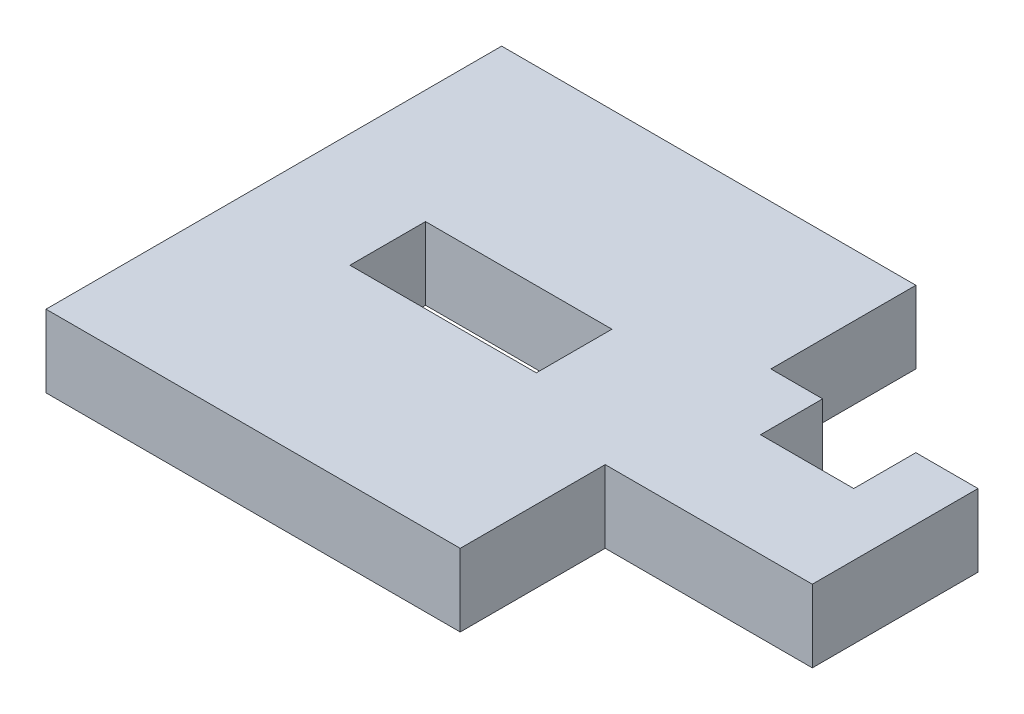
from build123d import *

# Parameters (mm, degrees)
SKETCH1_W           = 20
SKETCH1_H           = 22
SKETCH1_W_2         = 9
SKETCH1_H_2         = 3.65
BOSS_EXTRUDE1_DEPTH = 4
SKETCH2_W           = 10
SKETCH2_H           = 8
BOSS_EXTRUDE3_DEPTH = 4
SKETCH3_W           = 4.5
SKETCH3_H           = 3
CUT_EXTRUDE1_DEPTH  = 24.173260453
CHAMFER1_SIZE       = 0.5


with BuildPart() as part:
    # Sketch1 → Boss-Extrude1 (new body)
    with BuildSketch(Plane(origin=(0, 0, 0), x_dir=(1, 0, 0), z_dir=(0, 1, 0))):
        Rectangle(SKETCH1_W, SKETCH1_H)
        Rectangle(SKETCH1_W_2, SKETCH1_H_2, mode=Mode.SUBTRACT)
    extrude(amount=BOSS_EXTRUDE1_DEPTH)

    # Sketch2 → Boss-Extrude3 (add)
    with BuildSketch(Plane(origin=(0, 0, 0), x_dir=(1, 0, 0), z_dir=(0, 1, 0))):
        with Locations((15, 0)):
            Rectangle(SKETCH2_W, SKETCH2_H)
    extrude(amount=BOSS_EXTRUDE3_DEPTH)

    # Sketch3 → Cut-Extrude1 (cut, through all)
    with BuildSketch(Plane(origin=(0, 0, 0), x_dir=(1, 0, 0), z_dir=(0, 1, 0))):
        with Locations((14.75, 2.5)):
            Rectangle(SKETCH3_W, SKETCH3_H)
    extrude(amount=CUT_EXTRUDE1_DEPTH, mode=Mode.SUBTRACT)

    # Chamfer1
    chamfer1_edges = [part.edges().sort_by_distance(p)[0] for p in [
        (4.5, 0, 0),
        (0, 0, -1.825),
        (-4.5, 0, 0),
        (0, 0, 1.825),
        (10, 0, -7.5),
        (15, 0, 4),
        (20, 0, 0),
        (18.5, 0, -4),
        (11.25, 0, -4),
        (12.5, 0, -2.5),
        (14.75, 0, -1),
        (17, 0, -2.5),
        (0, 0, -11),
        (10, 0, 7.5),
        (0, 0, 11),
        (-10, 0, 0),
    ]]
    chamfer(chamfer1_edges, length=CHAMFER1_SIZE)


solid = part.part
